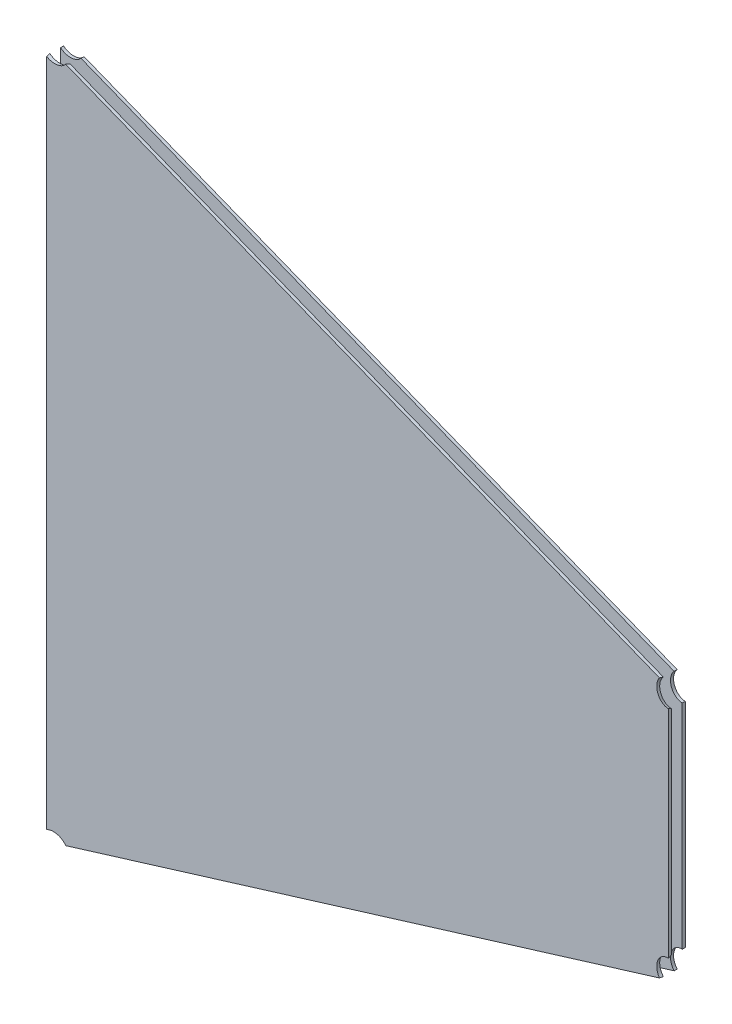
from build123d import *

# Parameters (mm, degrees)
BOSS_EXTRUDE1_DEPTH = 1.5875
SKETCH2_R           = 13.081
CUT_EXTRUDE1_DEPTH  = 901.16952554
SKETCH3_R           = 13.081
CUT_EXTRUDE2_DEPTH  = 1194.175059072
BOSS_EXTRUDE2_DEPTH = 3.175


with BuildPart() as part:
    # Sketch1 → Boss-Extrude1 (new, symmetric)
    with BuildSketch(Plane(origin=(1.607555501, 0, -38.136333964), x_dir=(0.9991127504631488, 0, 0.04211545870534549), z_dir=(-0.04211545870534549, 0, 0.999112750463149))):
        Polygon((208.330485626, 370.332), (905.518665515, 136.166603714), (905.518665515, -136.166603714), (208.330485626, -370.332), align=None)
    extrude(amount=BOSS_EXTRUDE1_DEPTH, both=True)

    # Sketch2 → Cut-Extrude1 (cut, through all)
    with BuildSketch(Plane(origin=(906.3228, 181.675109228, 111.497888082), x_dir=(1, 0, 0), z_dir=(0, 0.4228510617538768, 0.9061991942026981))):
        Circle(SKETCH2_R)
    cut_extrude1 = extrude(amount=-CUT_EXTRUDE1_DEPTH, mode=Mode.SUBTRACT)

    # Mirror1: Cut-Extrude1 across plane
    add(cut_extrude1.mirror(Plane.ZX), mode=Mode.SUBTRACT)

    # Sketch3 → Cut-Extrude2 (cut, symmetric)
    with BuildSketch(Plane(origin=(18.074015753, 370.332, 262.27306283), x_dir=(-0.8229553854788443, 0, -0.56810600552306), z_dir=(0.56810600552306, 0, -0.8229553854788443))):
        Circle(SKETCH3_R)
    cut_extrude2 = extrude(amount=CUT_EXTRUDE2_DEPTH, both=True, mode=Mode.SUBTRACT)

    # Mirror2: Cut-Extrude2 across plane
    add(cut_extrude2.mirror(Plane.ZX), mode=Mode.SUBTRACT)


with BuildPart() as body_2:
    # Sketch4 → Boss-Extrude2 (new body)
    with BuildSketch(Plane(origin=(2.142421827, 0, -50.825065895), x_dir=(0.9991127504631488, 0, 0.04211545870534549), z_dir=(-0.04211545870534549, 0, 0.999112750463149))):
        with BuildLine():
            Line((208.330485626, 360.637647396), (208.330485626, -360.637647396))
            add(Edge.make_bspline(
                [(231.218068965, -362.644721045), (221.095702884, -350.852329213), (208.330485626, -360.637647396)],
                knots=[3.769765679, 3.769765679, 3.769765679, 5.44847537, 5.44847537, 5.44847537], degree=2, weights=[1, 0.667943097, 1]))
            Line((231.218068965, -362.644721045), (896.450733287, -139.212260547))
            add(Edge.make_bspline(
                [(905.518665515, -114.472985943), (872.399197719, -113.635488894), (896.450733287, -139.212260547)],
                knots=[3.037122544, 3.037122544, 3.037122544, 5.425802301, 5.425802301, 5.425802301], degree=2, weights=[1, 0.367627377, 1]))
            Line((905.518665515, -114.472985943), (905.518665515, 114.472985943))
            add(Edge.make_bspline(
                [(896.450733287, 139.212260547), (872.399197719, 113.635488894), (905.518665515, 114.472985943)],
                knots=[0.857383007, 0.857383007, 0.857383007, 3.246062763, 3.246062763, 3.246062763], degree=2, weights=[1, 0.367627377, 1]))
            Line((896.450733287, 139.212260547), (231.218068965, 362.644721045))
            add(Edge.make_bspline(
                [(208.330485626, 360.637647396), (221.095702884, 350.852329213), (231.218068965, 362.644721045)],
                knots=[0.834709937, 0.834709937, 0.834709937, 2.513419628, 2.513419628, 2.513419628], degree=2, weights=[1, 0.667943097, 1]))
        make_face()
    extrude(amount=-BOSS_EXTRUDE2_DEPTH)


solid = Compound([part.part, body_2.part])
